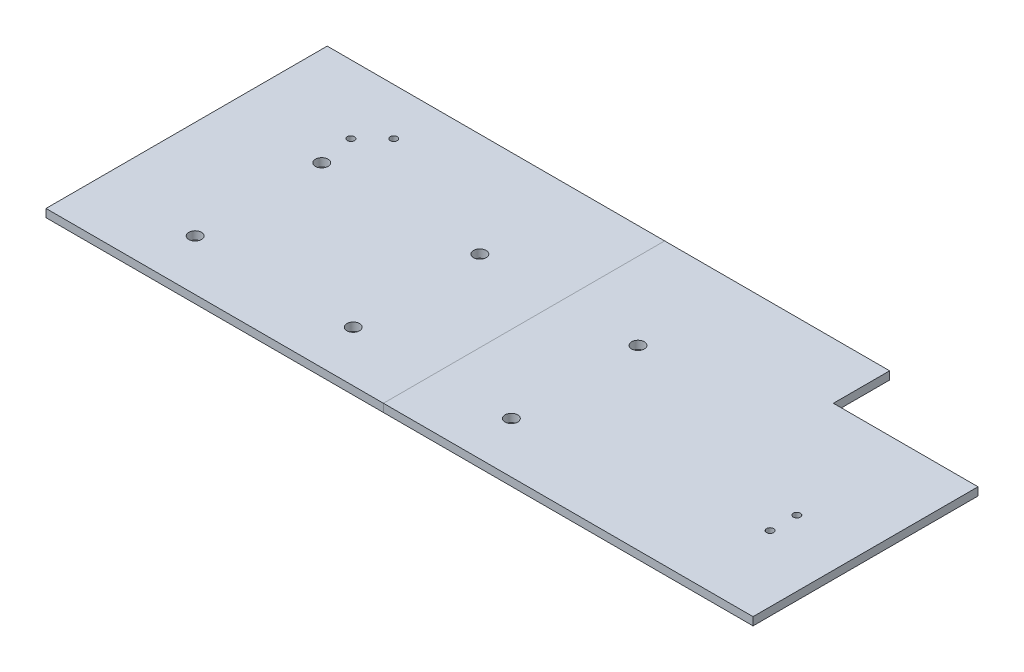
from build123d import *

# Parameters (mm, degrees)
BOSS_EXTRUDE1_DEPTH     = 6.35
CUT_EXTRUDE3_DEPTH      = 602.409033022
CUT_EXTRUDE3_DEPTH_BACK = 602.409033022
SKETCH10_R              = 5.0000027
SKETCH2_R               = 2.778125
CUT_EXTRUDE4_DEPTH      = 602.409033022
SPLIT1_SURFACE_1_BACK   = 602.409
SPLIT1_SURFACE_1_DEPTH  = 1204.818
SPLIT1_SURFACE_2_BACK   = 602.409
SPLIT1_SURFACE_2_DEPTH  = 1204.818


with BuildPart() as part:
    # Sketch1 → Boss-Extrude1 (new body)
    with BuildSketch(Plane(origin=(0, 0, 0), x_dir=(1, 0, 0), z_dir=(0, 1, 0))):
        Polygon((0, 0), (0, 177.8), (-114.3, 177.8), (-114.3, 222.25), (-558.8, 222.25), (-558.8, 0), align=None)
    extrude(amount=BOSS_EXTRUDE1_DEPTH)

    # Sketch10 → Cut-Extrude3 (cut, two sides: drawn at the far end of the back side and taken through both)
    with BuildSketch(Plane(origin=(0, 6.35, 0), x_dir=(1, 0, 0), z_dir=(0, 1, 0)).offset(-CUT_EXTRUDE3_DEPTH_BACK)):
        with Locations(Location((-481.076, 40.132, 0), (0, 0, 270))):
            Circle(SKETCH10_R)
        with Locations(Location((-356.108, 40.132, 0), (0, 0, 270))):
            Circle(SKETCH10_R)
        with Locations(Location((-231.14, 40.132, 0), (0, 0, 270))):
            Circle(SKETCH10_R)
        with Locations(Location((-356.108, 140.208, 0), (0, 0, 270))):
            Circle(SKETCH10_R)
        with Locations(Location((-231.14, 140.208, 0), (0, 0, 270))):
            Circle(SKETCH10_R)
        with Locations(Location((-481.076, 140.208, 0), (0, 0, 270))):
            Circle(SKETCH10_R)
    extrude(amount=CUT_EXTRUDE3_DEPTH + CUT_EXTRUDE3_DEPTH_BACK, mode=Mode.SUBTRACT)

    # Sketch2 → Cut-Extrude4 (cut, through all)
    with BuildSketch(Plane.XZ):
        with Locations(Location((-52.1589, -86.783333333, 0), (0, 0, 270))):
            Circle(SKETCH2_R)
        with Locations(Location((-52.1589, -65.616666667, 0), (0, 0, 270))):
            Circle(SKETCH2_R)
        with Locations(Location((-469.142233333, -185.187166667, 0), (0, 0, 270))):
            Circle(SKETCH2_R)
        with Locations(Location((-486.075566667, -168.253833333, 0), (0, 0, 270))):
            Circle(SKETCH2_R)
    extrude(amount=-CUT_EXTRUDE4_DEPTH, mode=Mode.SUBTRACT)


with BuildPart() as body_2:
    # Split1: the piece behind the surface
    add(part.part)
    # Split1 surface: a surface, the sketch's curves swept straight by 1204.818 mm
    with BuildLine(Plane(origin=(0, 6.35, 0), x_dir=(1, 0, 0), z_dir=(0, 1, 0)).offset(-SPLIT1_SURFACE_1_BACK), mode=Mode.PRIVATE) as split1_surface_1_path:
        Line((-292.1, 222.25), (-292.1, 0))
    split1_surface_1 = Shell.extrude(split1_surface_1_path.wire(), (0 * SPLIT1_SURFACE_1_DEPTH, 1 * SPLIT1_SURFACE_1_DEPTH, 0 * SPLIT1_SURFACE_1_DEPTH))
    split(bisect_by=split1_surface_1, keep=Keep.BOTTOM)


with BuildPart() as part_1:
    add(part.part)

    # Split1: split by a surface, the side it looks to stays
    # Split1 surface: a surface, the sketch's curves swept straight by 1204.818 mm
    with BuildLine(Plane(origin=(0, 6.35, 0), x_dir=(1, 0, 0), z_dir=(0, 1, 0)).offset(-SPLIT1_SURFACE_2_BACK), mode=Mode.PRIVATE) as split1_surface_2_path:
        Line((-292.1, 222.25), (-292.1, 0))
    split1_surface_2 = Shell.extrude(split1_surface_2_path.wire(), (0 * SPLIT1_SURFACE_2_DEPTH, 1 * SPLIT1_SURFACE_2_DEPTH, 0 * SPLIT1_SURFACE_2_DEPTH))
    split(bisect_by=split1_surface_2, keep=Keep.TOP)


solid = Compound([body_2.part, part_1.part])
